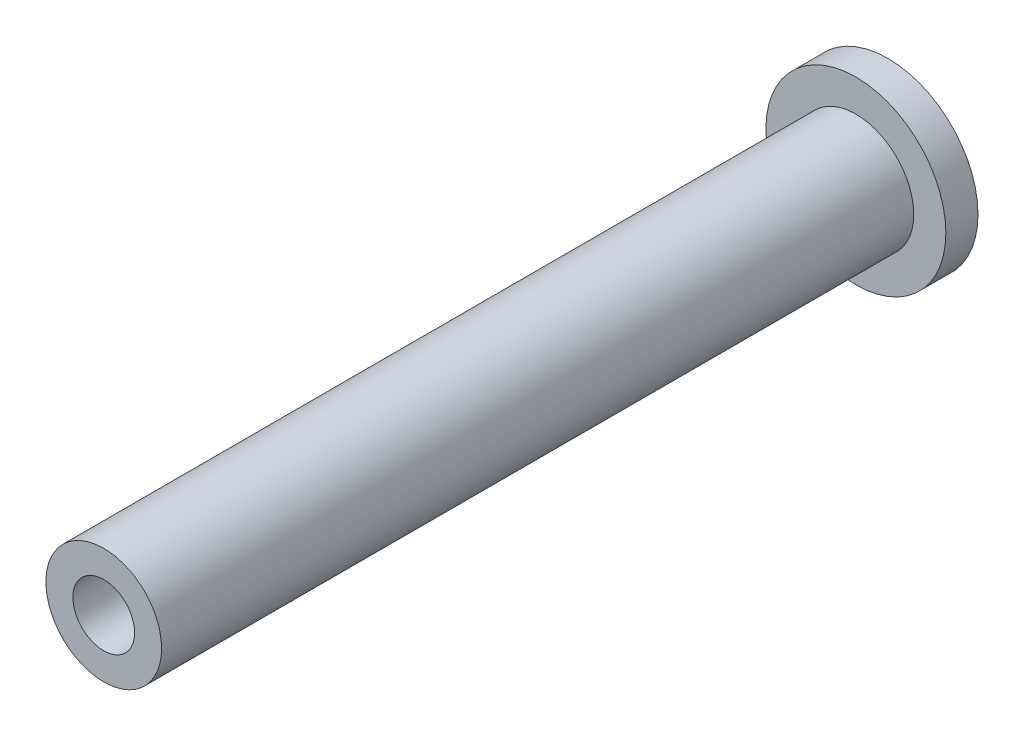
from build123d import *

# Parameters (mm, degrees)
SKETCH1_R           = 7
BOSS_EXTRUDE1_DEPTH = 2.5
SKETCH2_R           = 4.5
BOSS_EXTRUDE2_DEPTH = 58.5
SKETCH3_R           = 2.4
CUT_EXTRUDE1_DEPTH  = 5


with BuildPart() as part:
    # Sketch1 → Boss-Extrude1 (new body)
    with BuildSketch(Plane.XY):
        Circle(SKETCH1_R)
    extrude(amount=BOSS_EXTRUDE1_DEPTH)

    # Sketch2 → Boss-Extrude2 (add)
    with BuildSketch(Plane.XY.offset(2.5)):
        Circle(SKETCH2_R)
    extrude(amount=BOSS_EXTRUDE2_DEPTH)

    # Sketch3 → Cut-Extrude1 (cut)
    with BuildSketch(Plane.XY.offset(61)):
        Circle(SKETCH3_R)
    extrude(amount=-CUT_EXTRUDE1_DEPTH, mode=Mode.SUBTRACT)


solid = part.part
